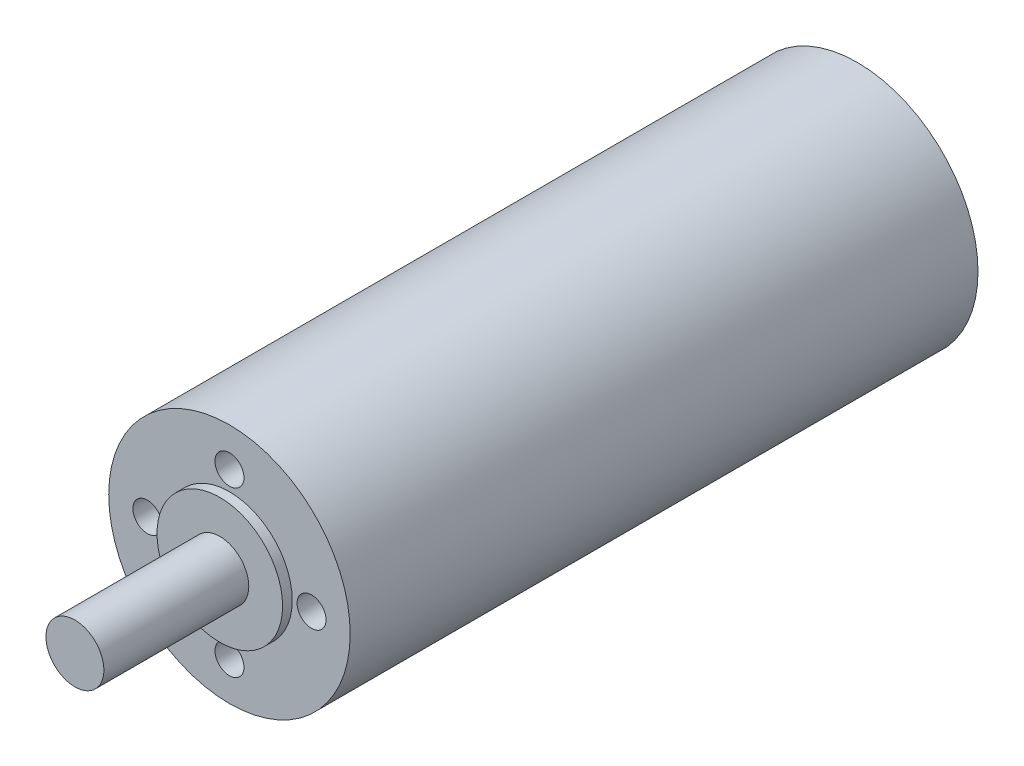
from build123d import *

# Parameters (mm, degrees)
ESBO_O1_R                = 12.5
RESSALTO_EXTRUS_O1_DEPTH = 65
ESBO_O2_R                = 6.5
RESSALTO_EXTRUS_O2_DEPTH = 1
ESBO_O3_R                = 3
RESSALTO_EXTRUS_O3_DEPTH = 15
ESBO_O4_R                = 1.5
CORTE_EXTRUS_O1_DEPTH    = 4
PADR_OCIRCULAR1_COUNT    = 4


with BuildPart() as part:
    # Esboço1 → Ressalto-extrusão1 (new body)
    with BuildSketch(Plane.XY):
        Circle(ESBO_O1_R)
    extrude(amount=RESSALTO_EXTRUS_O1_DEPTH)

    # Esboço2 → Ressalto-extrusão2 (add)
    with BuildSketch(Plane.XY.offset(65)):
        Circle(ESBO_O2_R)
    extrude(amount=RESSALTO_EXTRUS_O2_DEPTH)

    # Esboço3 → Ressalto-extrusão3 (add)
    with BuildSketch(Plane.XY.offset(66)):
        Circle(ESBO_O3_R)
    extrude(amount=RESSALTO_EXTRUS_O3_DEPTH)

    # Esboço4 → Corte-extrusão1 (cut)
    with BuildSketch(Plane.XY.offset(65)):
        with Locations((0, -8.5)):
            Circle(ESBO_O4_R)
    corte_extrus_o1 = extrude(amount=-CORTE_EXTRUS_O1_DEPTH, mode=Mode.SUBTRACT)

    # PadrãoCircular1: Corte-extrusão1 ×4 about axis
    padr_ocircular1_axis = Axis((0, 0, 0), (0, 0, 1))
    for i in range(1, PADR_OCIRCULAR1_COUNT):
        add(corte_extrus_o1.rotate(padr_ocircular1_axis, i * 360 / PADR_OCIRCULAR1_COUNT), mode=Mode.SUBTRACT)


solid = part.part
